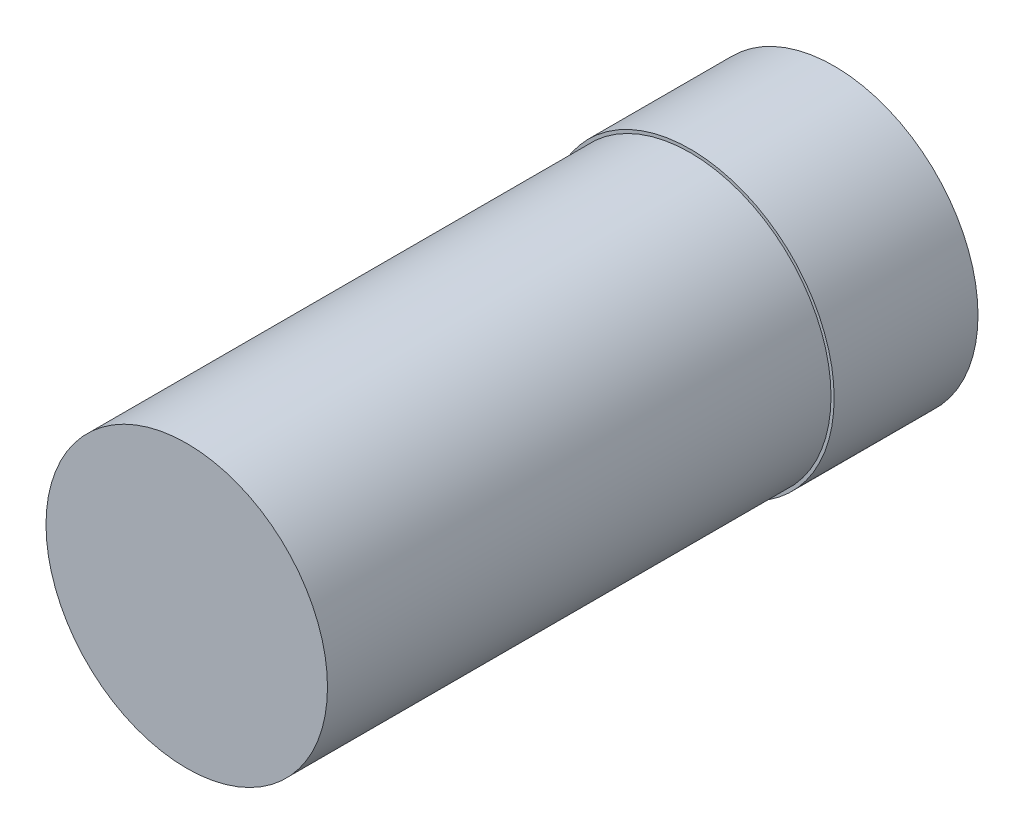
from build123d import *

# Parameters (mm, degrees)
SKETCH_1_R      = 3
EXTRUDE_1_DEPTH = 3
SKETCH_2_R      = 2.935
EXTRUDE_2_DEPTH = 10.5


with BuildPart() as part:
    # 스케치1 → 보스-돌출1 (new body)
    with BuildSketch(Plane.XY):
        Circle(SKETCH_1_R)
    extrude(amount=EXTRUDE_1_DEPTH)

    # 스케치2 → 보스-돌출2 (add)
    with BuildSketch(Plane.XY.offset(3)):
        with Locations(Location((0, 0, 0), (0, 0, 180))):
            Circle(SKETCH_2_R)
    extrude(amount=EXTRUDE_2_DEPTH)


solid = part.part
